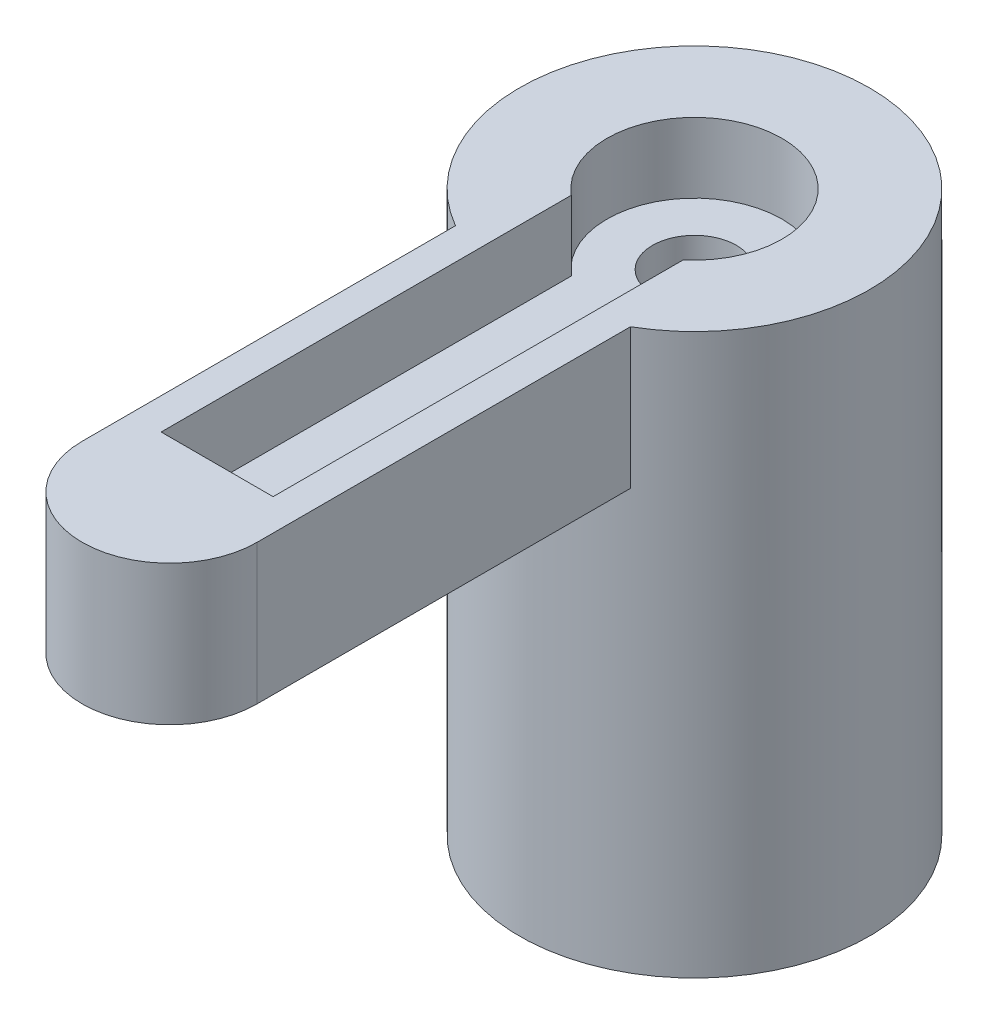
from build123d import *

# Parameters (mm, degrees)
SKETCH1_R           = 1.524
BOSS_EXTRUDE1_DEPTH = 5.08
SKETCH2_R           = 3.175
SKETCH2_W           = 4.064
SKETCH2_H           = 17.78
CUT_EXTRUDE1_DEPTH  = 2.54
BOSS_EXTRUDE2_START = 15.24
SKETCH3_R           = 6.35
BOSS_EXTRUDE2_DEPTH = 15.24
SKETCH4_R           = 3.429
CUT_EXTRUDE2_DEPTH  = 15.24


with BuildPart() as part:
    # Sketch1 → Boss-Extrude1 (new body)
    with BuildSketch(Plane(origin=(0, 0, 0), x_dir=(1, 0, 0), z_dir=(0, 1, 0))):
        with BuildLine():
            ThreePointArc((3.175, -5.499261314), (0, 6.35), (-3.175, -5.499261314))
            Line((-3.175, -5.499261314), (-3.175, -19.05))
            ThreePointArc((-3.175, -19.05), (0, -22.225), (3.175, -19.05))
            Line((3.175, -19.05), (3.175, -5.499261314))
        make_face()
        with Locations(Location((0, 0, 0), (0, 0, 270))):
            Circle(SKETCH1_R, mode=Mode.SUBTRACT)
    extrude(amount=BOSS_EXTRUDE1_DEPTH)

    # Sketch2 → Cut-Extrude1 (cut)
    with BuildSketch(Plane(origin=(0, 5.08, 0), x_dir=(1, 0, 0), z_dir=(0, 1, 0))):
        Circle(SKETCH2_R)
        with Locations((0, -8.434547342)):
            Rectangle(SKETCH2_W, SKETCH2_H)
    extrude(amount=-CUT_EXTRUDE1_DEPTH, mode=Mode.SUBTRACT)

    # Sketch3 → Boss-Extrude2 (add)
    with BuildSketch(Plane.XZ.offset(BOSS_EXTRUDE2_START)):
        with Locations(Location((0, 0, 0), (0, 0, 270))):
            Circle(SKETCH3_R)
    extrude(amount=-BOSS_EXTRUDE2_DEPTH)

    # Sketch4 → Cut-Extrude2 (cut)
    with BuildSketch(Plane.XZ.offset(15.24)):
        with Locations(Location((0, 0, 0), (0, 0, 270))):
            Circle(SKETCH4_R)
    extrude(amount=-CUT_EXTRUDE2_DEPTH, mode=Mode.SUBTRACT)


solid = part.part
